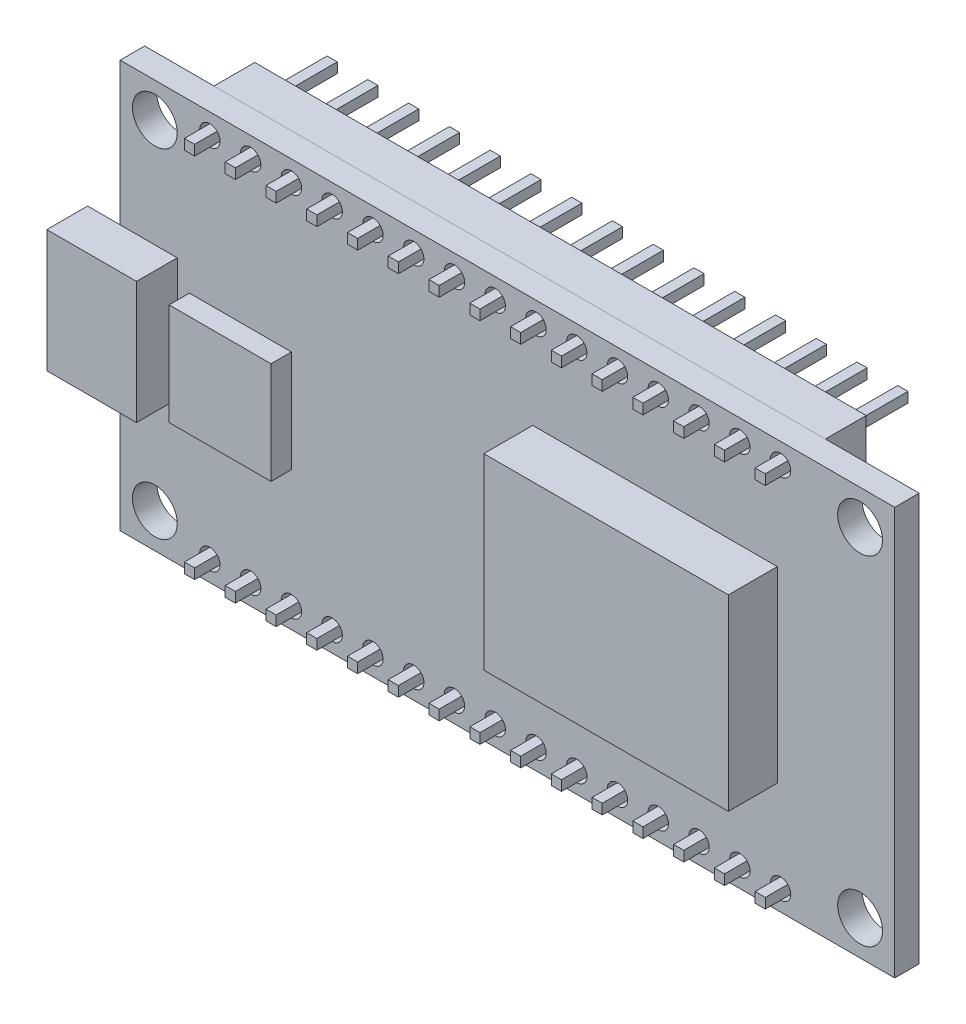
from build123d import *

# Parameters (mm, degrees)
SKETCH1_W             = 48.26
SKETCH1_H             = 25.4
BOSS_EXTRUDE1_DEPTH   = 1.524
SKETCH2_R             = 1.397
CUT_EXTRUDE1_DEPTH    = 55.557402577
SKETCH3_W             = 15.24
SKETCH3_H             = 11.684
BOSS_EXTRUDE2_DEPTH   = 3.048
SKETCH3_3_W           = 5.588
SKETCH3_3_H           = 7.62
BOSS_EXTRUDE3_DEPTH   = 2.54
SKETCH3_4_W           = 6.35
SKETCH3_4_H           = 6.35
BOSS_EXTRUDE4_DEPTH   = 1.27
SKETCH4_R             = 0.635
CUT_EXTRUDE2_DEPTH    = 55.621222103
LPATTERN1_COUNT       = 15
LPATTERN1_PITCH       = 2.54
SKETCH5_W             = 38.1
SKETCH5_H             = 2.54
BOSS_EXTRUDE5_DEPTH   = 2.54
BOSS_EXTRUDE5_2_DEPTH = 2.54
SKETCH6_W             = 0.635
SKETCH6_H             = 0.635
BOSS_EXTRUDE6_DEPTH   = 8.89
BOSS_EXTRUDE6_2_DEPTH = 8.89
LPATTERN2_COUNT       = 15
LPATTERN2_PITCH       = 2.54


with BuildPart() as part:
    # Sketch1 → Boss-Extrude1 (new body)
    with BuildSketch(Plane.XY):
        with Locations((24.13, 12.7)):
            Rectangle(SKETCH1_W, SKETCH1_H)
    extrude(amount=BOSS_EXTRUDE1_DEPTH)

    # Sketch2 → Cut-Extrude1 (cut, through all)
    with BuildSketch(Plane.XY.offset(1.524)):
        with Locations((2.159, 23.241)):
            Circle(SKETCH2_R)
        with Locations((46.101, 23.241)):
            Circle(SKETCH2_R)
        with Locations((46.101, 2.159)):
            Circle(SKETCH2_R)
        with Locations((2.159, 2.159)):
            Circle(SKETCH2_R)
    extrude(amount=-CUT_EXTRUDE1_DEPTH, mode=Mode.SUBTRACT)

    # Sketch3 → Boss-Extrude2 (add)
    with BuildSketch(Plane.XY.offset(1.524)):
        with Locations((33.3248, 12.7)):
            Rectangle(SKETCH3_W, SKETCH3_H)
    extrude(amount=BOSS_EXTRUDE2_DEPTH)

    # Sketch3<3> → Boss-Extrude3 (add)
    with BuildSketch(Plane.XY.offset(1.524)):
        with Locations((0.762, 12.7)):
            Rectangle(SKETCH3_3_W, SKETCH3_3_H)
    extrude(amount=BOSS_EXTRUDE3_DEPTH)

    # Sketch3<4> → Boss-Extrude4 (add)
    with BuildSketch(Plane.XY.offset(1.524)):
        with Locations((7.493, 11.811)):
            Rectangle(SKETCH3_4_W, SKETCH3_4_H)
    extrude(amount=BOSS_EXTRUDE4_DEPTH)

    # Sketch4 → Cut-Extrude2 (cut, symmetric)
    with BuildSketch(Plane.XY.offset(1.524)):
        with Locations((5.588, 24.13)):
            Circle(SKETCH4_R)
        with Locations((5.588, 1.27)):
            Circle(SKETCH4_R)
    cut_extrude2 = extrude(amount=CUT_EXTRUDE2_DEPTH, both=True, mode=Mode.SUBTRACT)

    # LPattern1: Cut-Extrude2 ×15
    with Locations(*[(i * LPATTERN1_PITCH, 0, 0) for i in range(1, LPATTERN1_COUNT)]):
        add(cut_extrude2, mode=Mode.SUBTRACT)


with BuildPart() as body_2:
    # Sketch5 → Boss-Extrude5 (new body)
    with BuildSketch(Plane(origin=(0, 0, 0), x_dir=(-1, 0, 0), z_dir=(0, 0, -1))):
        with Locations((-23.368, 24.13)):
            Rectangle(SKETCH5_W, SKETCH5_H)
    extrude(amount=BOSS_EXTRUDE5_DEPTH)


with BuildPart() as body_3:
    # Sketch5 → Boss-Extrude5 2 (new body)
    with BuildSketch(Plane(origin=(0, 0, 0), x_dir=(-1, 0, 0), z_dir=(0, 0, -1))):
        with Locations((-23.368, 1.27)):
            Rectangle(SKETCH5_W, SKETCH5_H)
    extrude(amount=BOSS_EXTRUDE5_2_DEPTH)


with BuildPart() as body_4:
    # Sketch6 → Boss-Extrude6 (new body)
    with BuildSketch(Plane.XY.offset(2.794)):
        with Locations((5.588, 24.13)):
            Rectangle(SKETCH6_W, SKETCH6_H)
    boss_extrude6 = extrude(amount=-BOSS_EXTRUDE6_DEPTH)


with BuildPart() as body_5:
    # Sketch6 → Boss-Extrude6 2 (new body)
    with BuildSketch(Plane.XY.offset(2.794)):
        with Locations((5.588, 1.27)):
            Rectangle(SKETCH6_W, SKETCH6_H)
    boss_extrude6_2 = extrude(amount=-BOSS_EXTRUDE6_2_DEPTH)


with BuildPart() as lpattern2_1:
    # LPattern2: Boss-Extrude6, Boss-Extrude6 2 ×15
    with Locations(*[(i * LPATTERN2_PITCH, 0, 0) for i in range(1, LPATTERN2_COUNT)]):
        add(boss_extrude6)
        add(boss_extrude6_2)


solid = Compound([part.part, body_2.part, body_3.part, body_4.part, body_5.part, lpattern2_1.part])
